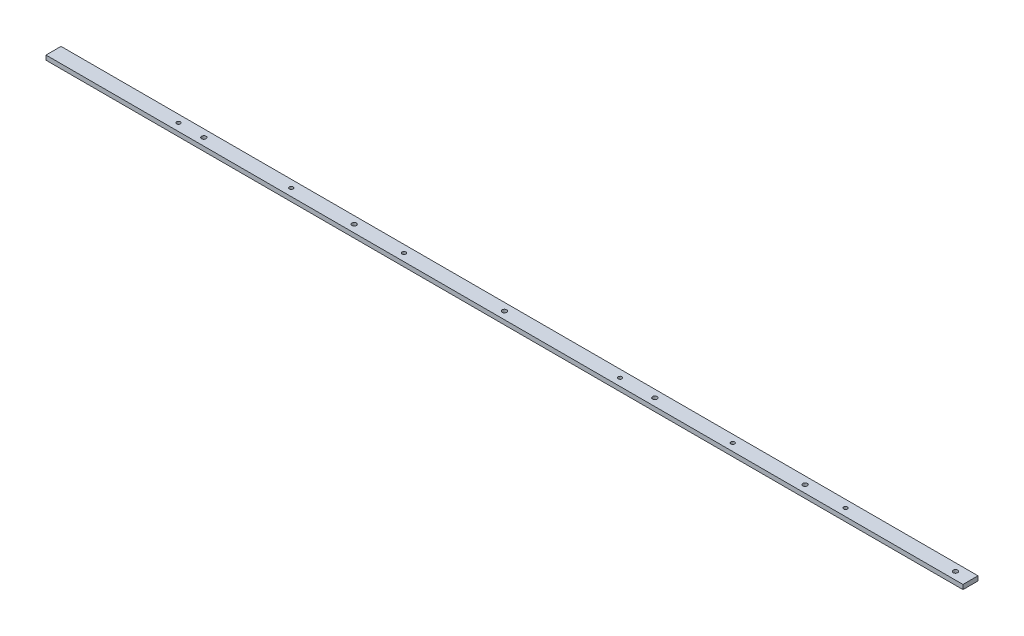
from build123d import *

# Parameters (mm, degrees)
SKETCH1_W           = 20
SKETCH1_H           = 6
BOSS_EXTRUDE1_DEPTH = 1220
SKETCH2_R           = 3
CUT_EXTRUDE1_DEPTH  = 1221.055736432
M6_TAPPED_HOLE1_D   = 5


with BuildPart() as part:
    # Sketch1 → Boss-Extrude1 (new body)
    with BuildSketch(Plane(origin=(0, 0, 0), x_dir=(0, 0, -1), z_dir=(1, 0, 0))):
        with Locations((0, 3)):
            Rectangle(SKETCH1_W, SKETCH1_H)
    extrude(amount=BOSS_EXTRUDE1_DEPTH)

    # Sketch2 → Cut-Extrude1 (cut, through all)
    with BuildSketch(Plane(origin=(0, 6, 0), x_dir=(1, 0, 0), z_dir=(0, 1, 0))):
        with Locations(Location((200, 0, 0), (0, 0, 270))):
            Circle(SKETCH2_R)
        with Locations(Location((400, 0, 0), (0, 0, 270))):
            Circle(SKETCH2_R)
        with Locations(Location((600, 0, 0), (0, 0, 270))):
            Circle(SKETCH2_R)
        with Locations(Location((800, 0, 0), (0, 0, 270))):
            Circle(SKETCH2_R)
        with Locations(Location((1000, 0, 0), (0, 0, 270))):
            Circle(SKETCH2_R)
        with Locations(Location((1200, 0, 0), (0, 0, 270))):
            Circle(SKETCH2_R)
    extrude(amount=-CUT_EXTRUDE1_DEPTH, mode=Mode.SUBTRACT)

    # M6 Tapped Hole1 (through all)
    with Locations(Plane(origin=(0, 6, 0), x_dir=(1, 0, 0), z_dir=(0, 1, 0))):
        with Locations((1053.75, 0), (166.25, 0), (316.25, 0), (466.25, 0), (753.75, 0), (903.75, 0)):
            Hole(M6_TAPPED_HOLE1_D / 2)


solid = part.part
